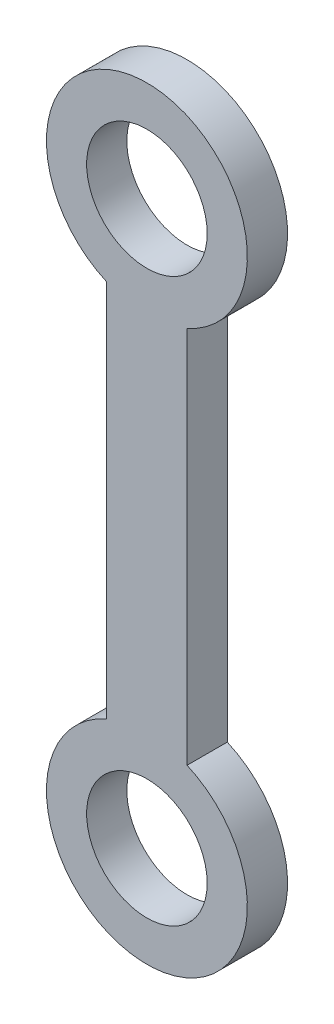
from build123d import *

# Parameters (mm, degrees)
ESQUISSE1_R        = 15
BOSS_EXTRU_1_DEPTH = 10


with BuildPart() as part:
    # Esquisse1 → Boss.-Extru.1 (new body)
    with BuildSketch(Plane.XY):
        with BuildLine():
            Line((-10, 117.087121525), (-10, 22.912878475))
            ThreePointArc((-10, 22.912878475), (0, -25), (10, 22.912878475))
            Line((10, 22.912878475), (10, 117.087121525))
            ThreePointArc((10, 117.087121525), (0, 165), (-10, 117.087121525))
        make_face()
        Circle(ESQUISSE1_R, mode=Mode.SUBTRACT)
        with Locations((0, 140)):
            Circle(ESQUISSE1_R, mode=Mode.SUBTRACT)
    extrude(amount=BOSS_EXTRU_1_DEPTH)


solid = part.part
